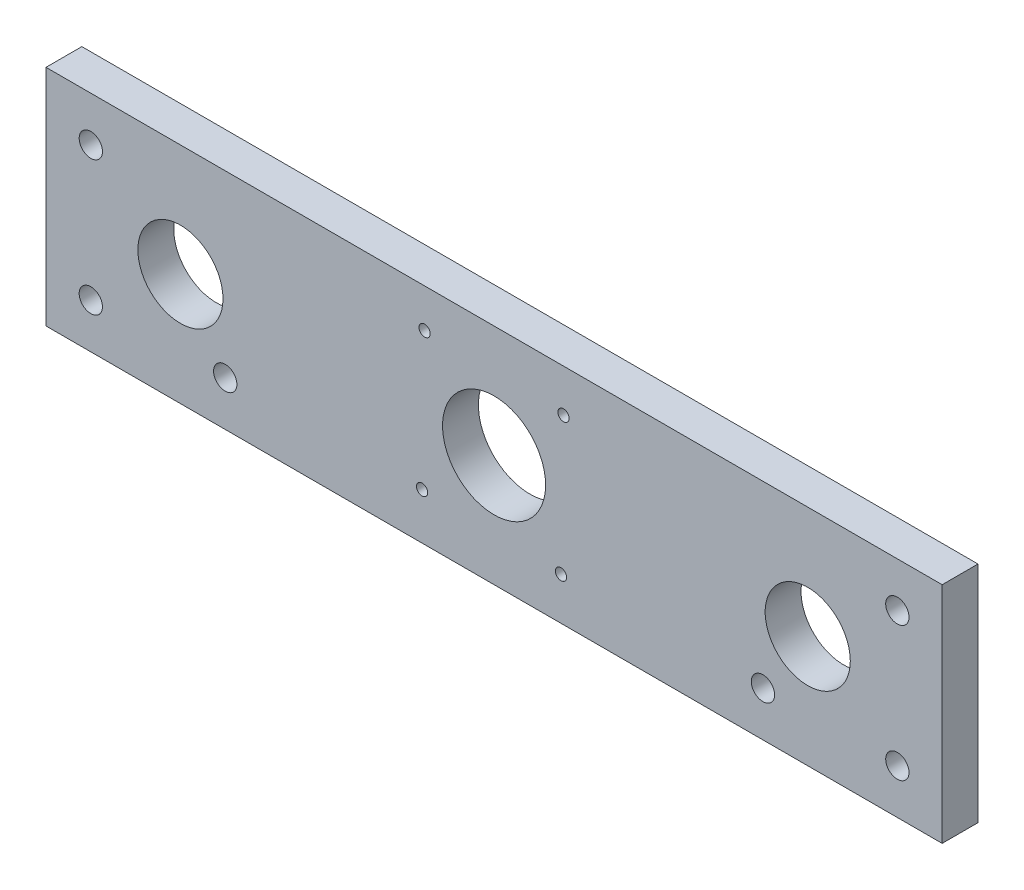
from build123d import *

# Parameters (mm, degrees)
IZIM1_W                              = 100
IZIM1_H                              = 50
IZIM1_R                              = 2.476303865
IZIM1_R_2                            = 9.5
IZIM1_R_3                            = 2.283039358
Y_KSEKLIK_EKSTR_ZYON1_DEPTH          = 8
M5_HELISARMAL_I_IN_Z_VANA_MATKAB_1_D = 5.2
KES_EKSTR_ZYON1_DEPTH                = 10
KES_EKSTR_ZYON1_DEPTH_BACK           = 10
IZIM4_R                              = 11.5
IZIM4_R_2                            = 1.25
M5_HELISARMAL_I_IN_Z_VANA_MATKAB_2_D = 5.2


with BuildPart() as part:
    # Çizim1 → Yükseklik-Ekstrüzyon1 (new body)
    # profile 1 of 6: a face of its own
    with BuildSketch(Plane.XY):
        with Locations((91.850220264, -26.688693098)):
            Rectangle(IZIM1_W, IZIM1_H)
        with Locations((131.850220264, -41.688693098)):
            Circle(IZIM1_R, mode=Mode.SUBTRACT)
        with Locations((111.850220264, -26.688693098)):
            Circle(IZIM1_R_2, mode=Mode.SUBTRACT)
        with Locations((131.850220264, -11.688693098)):
            Circle(IZIM1_R_3, mode=Mode.SUBTRACT)
    # profile 2 of 6: a face of its own
    with BuildSketch(Plane.XY):
        with Locations((-8.149779736, -26.688693098)):
            Rectangle(IZIM1_W, IZIM1_H)
        with Locations((-48.149779736, -41.688693098)):
            Circle(IZIM1_R, mode=Mode.SUBTRACT)
        with Locations((-28.149779736, -26.688693098)):
            Circle(IZIM1_R_2, mode=Mode.SUBTRACT)
        with Locations((-48.149779736, -11.688693098)):
            Circle(IZIM1_R_3, mode=Mode.SUBTRACT)
    # profile 3 of 6: a face of its own
    with BuildSketch(Plane.XY):
        with Locations((-48.149779736, -11.688693098)):
            Circle(IZIM1_R_3)
    # profile 4 of 6: a face of its own
    with BuildSketch(Plane.XY):
        with Locations((-48.149779736, -41.688693098)):
            Circle(IZIM1_R)
    # profile 5 of 6: a face of its own
    with BuildSketch(Plane.XY):
        with Locations((131.850220264, -11.688693098)):
            Circle(IZIM1_R_3)
    # profile 6 of 6: a face of its own
    with BuildSketch(Plane.XY):
        with Locations((131.850220264, -41.688693098)):
            Circle(IZIM1_R)
    extrude(amount=Y_KSEKLIK_EKSTR_ZYON1_DEPTH)

    # M5 Helisarmal için Zıvana matkabı1 (through all)
    with Locations(Plane.XY.offset(8)):
        with Locations((-48.149779736, -11.688693098), (-48.149779736, -41.688693098), (131.850220264, -41.688693098), (131.850220264, -11.688693098)):
            Hole(M5_HELISARMAL_I_IN_Z_VANA_MATKAB_1_D / 2)

    # Çizim4 → Kes-Ekstrüzyon1 (cut, two sides: drawn at the far end of the back side and taken through both)
    with BuildSketch(Plane(origin=(0, 0, 0), x_dir=(-1, 0, 0), z_dir=(0, 0, -1)).offset(-KES_EKSTR_ZYON1_DEPTH_BACK)):
        with Locations(Location((-41.850220264, -26.688693098, 0), (0, 0, 180))):
            Circle(IZIM4_R)
        with Locations(Location((-57.350220264, -11.188693098, 0), (0, 0, 180))):
            Circle(IZIM4_R_2)
        with Locations(Location((-56.781535146, -42.188693098, 0), (0, 0, 180))):
            Circle(IZIM4_R_2)
        with Locations(Location((-25.781535146, -41.329010258, 0), (0, 0, 180))):
            Circle(IZIM4_R_2)
        with Locations(Location((-26.350220264, -10.329010258, 0), (0, 0, 180))):
            Circle(IZIM4_R_2)
    extrude(amount=KES_EKSTR_ZYON1_DEPTH + KES_EKSTR_ZYON1_DEPTH_BACK, mode=Mode.SUBTRACT)

    # M5 Helisarmal için Zıvana matkabı2 (through all)
    with Locations(Plane(origin=(-18.149779736, -41.688693098, 8), x_dir=(1, 0, 0), z_dir=(0, 0, 1))):
        with Locations((0, 0), (120, 0)):
            Hole(M5_HELISARMAL_I_IN_Z_VANA_MATKAB_2_D / 2)


solid = part.part
